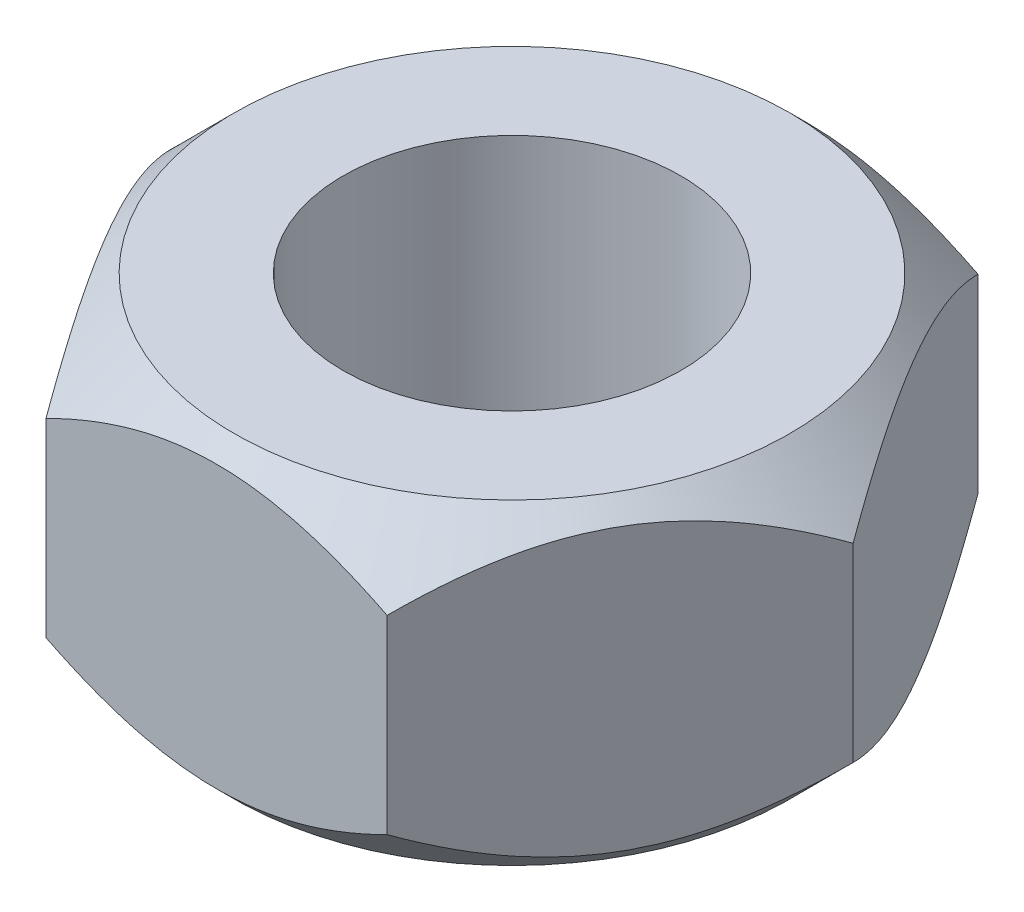
from build123d import *

# Parameters (mm, degrees)
SKETCH1_R           = 8
BOSS_EXTRUDE1_DEPTH = 7.5


with BuildPart() as part:
    # Sketch1 → Boss-Extrude1 (new, symmetric)
    with BuildSketch(Plane(origin=(0, 0, 0), x_dir=(1, 0, 0), z_dir=(0, 1, 0))):
        Polygon((16.165807537, 0), (8.082903769, 14), (-8.082903769, 14), (-16.165807537, 0), (-8.082903769, -14), (8.082903769, -14), align=None)
        with Locations(Location((0, 0, 0), (0, 0, 270))):
            Circle(SKETCH1_R, mode=Mode.SUBTRACT)
    extrude(amount=BOSS_EXTRUDE1_DEPTH, both=True)

    # Sketch2 → Cut-Revolve1 (revolve, cut)
    with BuildSketch(Plane.XY, mode=Mode.PRIVATE) as cut_revolve1_sk:
        Polygon((13.165807537, 7.5), (16.165807537, 4.5), (16.165807537, 7.5), align=None)
    cut_revolve1 = revolve(cut_revolve1_sk.sketch.rotate(Axis((0, 0, 0), (0, 1, 0)), 90), axis=Axis((0, 0, 0), (0, 1, 0)), mode=Mode.SUBTRACT)

    # Mirror1: Cut-Revolve1 across plane
    add(cut_revolve1.mirror(Plane.ZX), mode=Mode.SUBTRACT)


solid = part.part
